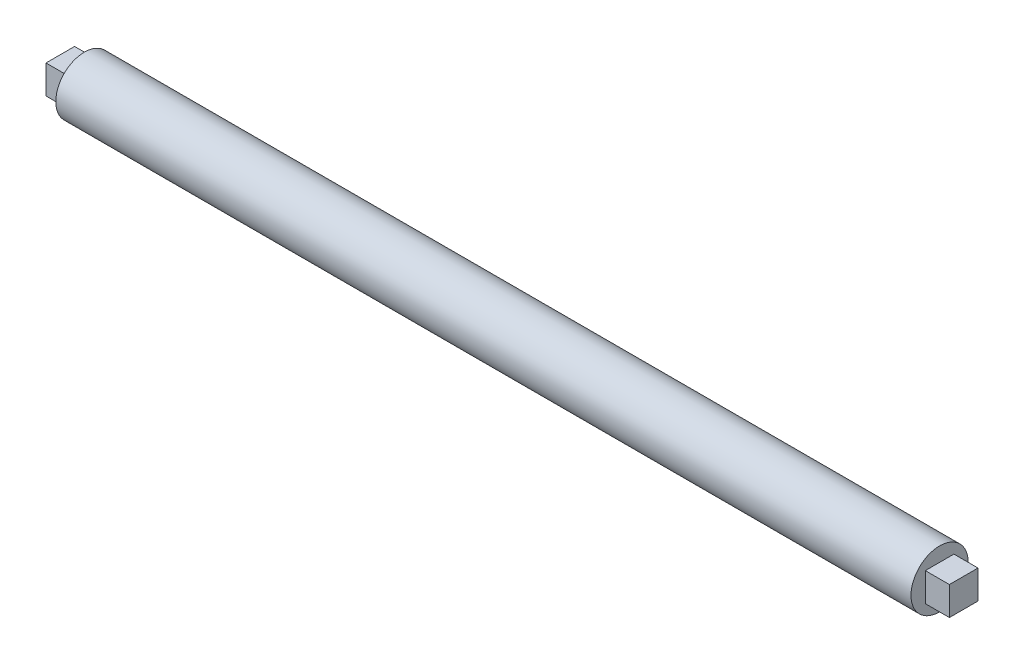
from build123d import *

# Parameters (mm, degrees)
ESQUISSE5_W        = 4.75
ESQUISSE5_H        = 4.75
BOSS_EXTRU_3_DEPTH = 4
BOSS_EXTRU_4_DEPTH = 4


with BuildPart() as part:
    # Esquisse1 → Révolution1 (revolve)
    with BuildSketch(Plane(origin=(0, 0, 0), x_dir=(1, 0, 0), z_dir=(0, 1, 0))):
        Polygon((0, 0), (0, 4.75), (142, 4.75), (142, 0), (125.25, 0), (117.25, 0), (24.75, 0), (16.75, 0), align=None)
    revolve(axis=Axis((0, 0, -4.75), (1, 0, 0)))

    # Esquisse5 → Boss.-Extru.3 (add)
    with BuildSketch(Plane(origin=(142, 0, 0), x_dir=(0, 0, -1), z_dir=(1, 0, 0))):
        with Locations((4.75, 0)):
            Rectangle(ESQUISSE5_W, ESQUISSE5_H)
    extrude(amount=BOSS_EXTRU_3_DEPTH)

    # Esquisse6 → Boss.-Extru.4 (add)
    with BuildSketch(Plane.ZY):
        Polygon((-4.75, 2.375), (-7.125, 2.375), (-7.125, -2.375), (-2.375, -2.375), (-2.375, 2.375), align=None)
    extrude(amount=BOSS_EXTRU_4_DEPTH)


solid = part.part
